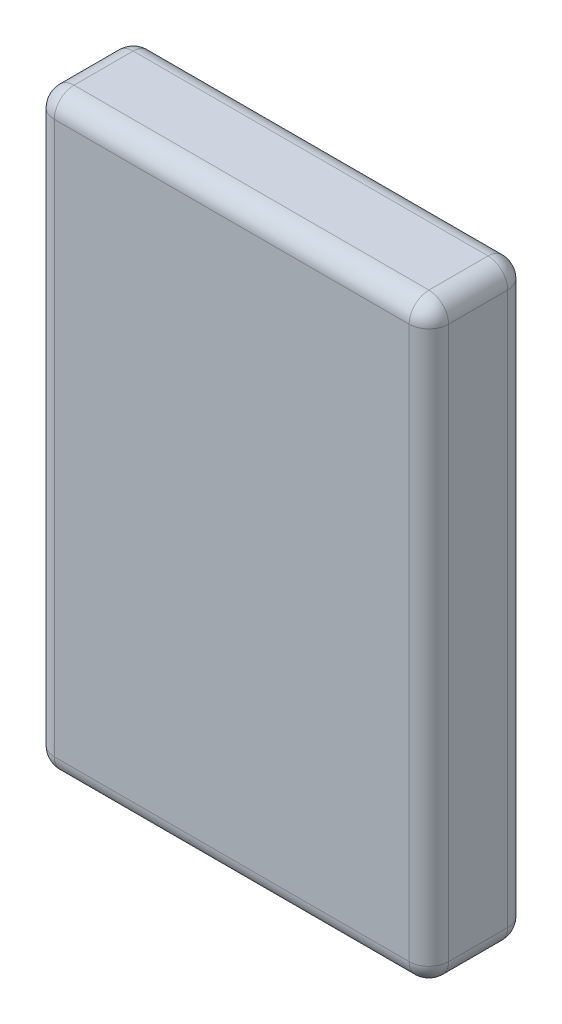
from build123d import *

# Parameters (mm, degrees)
SKETCH_1_W      = 4
SKETCH_1_H      = 6
EXTRUDE_1_DEPTH = 1
FILLET_1_R      = 0.2


with BuildPart() as part:
    # Эскиз1 → Бобышка-Вытянуть1 (new body)
    with BuildSketch(Plane.XY):
        Rectangle(SKETCH_1_W, SKETCH_1_H)
    extrude(amount=EXTRUDE_1_DEPTH)

    # Скругление1
    fillet_1_edges = [part.edges().sort_by_distance(p)[0] for p in [
        (-2, 0, 1),
        (0, -3, 1),
        (2, 0, 1),
        (0, -3, 0),
        (-2, 0, 0),
        (0, 3, 0),
        (2, 0, 0),
        (0, 3, 1),
        (2, -3, 0.5),
        (-2, -3, 0.5),
        (-2, 3, 0.5),
        (2, 3, 0.5),
    ]]
    fillet(fillet_1_edges, radius=FILLET_1_R)


solid = part.part
